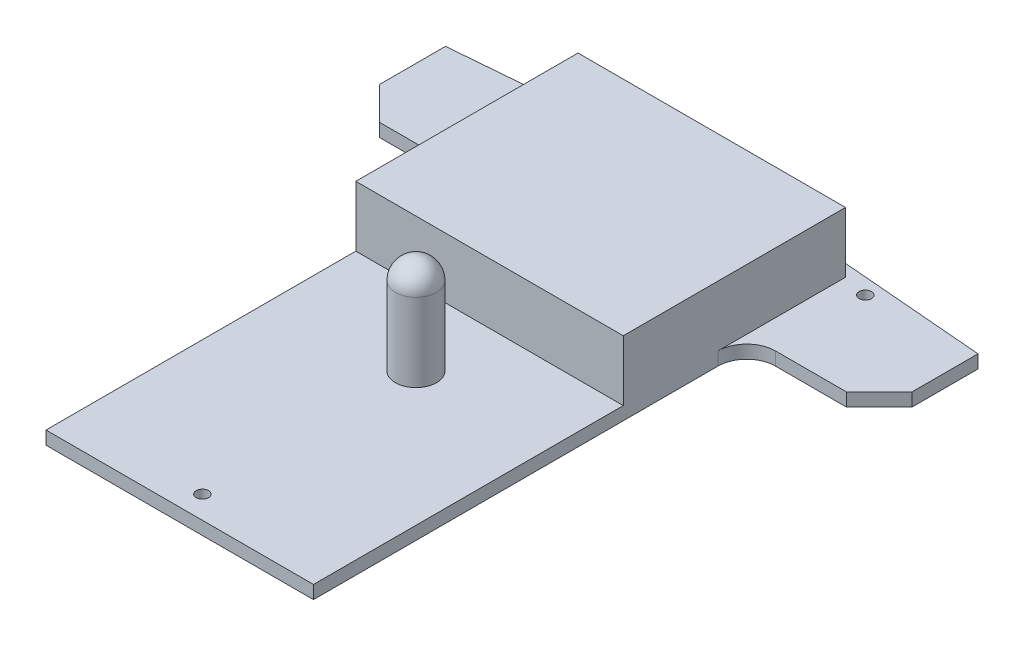
from build123d import *

# Parameters (mm, degrees)
SKETCH1_R           = 0.75
BOSS_EXTRUDE1_DEPTH = 1.6
SKETCH2_W           = 32.5
SKETCH2_H           = 27
BOSS_EXTRUDE2_DEPTH = 7.35
SKETCH3_R           = 2.5
BOSS_EXTRUDE3_DEPTH = 12
FILLET1_R           = 2.5


with BuildPart() as part:
    # Sketch1 → Boss-Extrude1 (new body)
    with BuildSketch(Plane(origin=(0, 0, 0), x_dir=(1, 0, 0), z_dir=(0, 1, 0))):
        with BuildLine():
            Line((-16.25, 0), (16.25, 0))
            Line((16.25, 0), (16.25, 49.14))
            ThreePointArc((16.25, 49.14), (17.275126266, 51.614873734), (19.75, 52.64))
            Line((19.75, 52.64), (28.35, 52.64))
            Line((28.35, 52.64), (32.35, 56.64))
            Line((32.35, 56.64), (32.35, 64.64))
            Line((32.35, 64.64), (8.35, 66.64))
            Line((8.35, 66.64), (8.35, 64.64))
            Line((8.35, 64.64), (-8.35, 64.64))
            Line((-8.35, 64.64), (-8.35, 66.64))
            Line((-8.35, 66.64), (-32.35, 64.64))
            Line((-32.35, 64.64), (-32.35, 56.64))
            Line((-32.35, 56.64), (-28.35, 52.64))
            Line((-28.35, 52.64), (-19.75, 52.64))
            ThreePointArc((-19.75, 52.64), (-17.275126266, 51.614873734), (-16.25, 49.14))
            Line((-16.25, 49.14), (-16.25, 0))
        make_face()
        with Locations(Location((-19.33, 63.968934124, 0), (0, 0, 270))):
            Circle(SKETCH1_R, mode=Mode.SUBTRACT)
        with Locations(Location((19.33, 63.968934124, 0), (0, 0, 270))):
            Circle(SKETCH1_R, mode=Mode.SUBTRACT)
        with Locations(Location((0, 2.75, 0), (0, 0, 270))):
            Circle(SKETCH1_R, mode=Mode.SUBTRACT)
    extrude(amount=BOSS_EXTRUDE1_DEPTH)

    # Sketch2 → Boss-Extrude2 (add)
    with BuildSketch(Plane(origin=(0, 1.6, 0), x_dir=(1, 0, 0), z_dir=(0, 1, 0))):
        with Locations((0, 51.14)):
            Rectangle(SKETCH2_W, SKETCH2_H)
    extrude(amount=BOSS_EXTRUDE2_DEPTH)

    # Sketch3 → Boss-Extrude3 (add)
    with BuildSketch(Plane(origin=(0, 1.6, 0), x_dir=(1, 0, 0), z_dir=(0, 1, 0))):
        with Locations(Location((0, 28.7, 0), (0, 0, 90))):
            Circle(SKETCH3_R)
    extrude(amount=BOSS_EXTRUDE3_DEPTH)

    # Fillet1
    fillet1_edges = [part.edges().sort_by_distance(p)[0] for p in [
        (0, 13.6, -26.2),
    ]]
    fillet(fillet1_edges, radius=FILLET1_R)


solid = part.part
